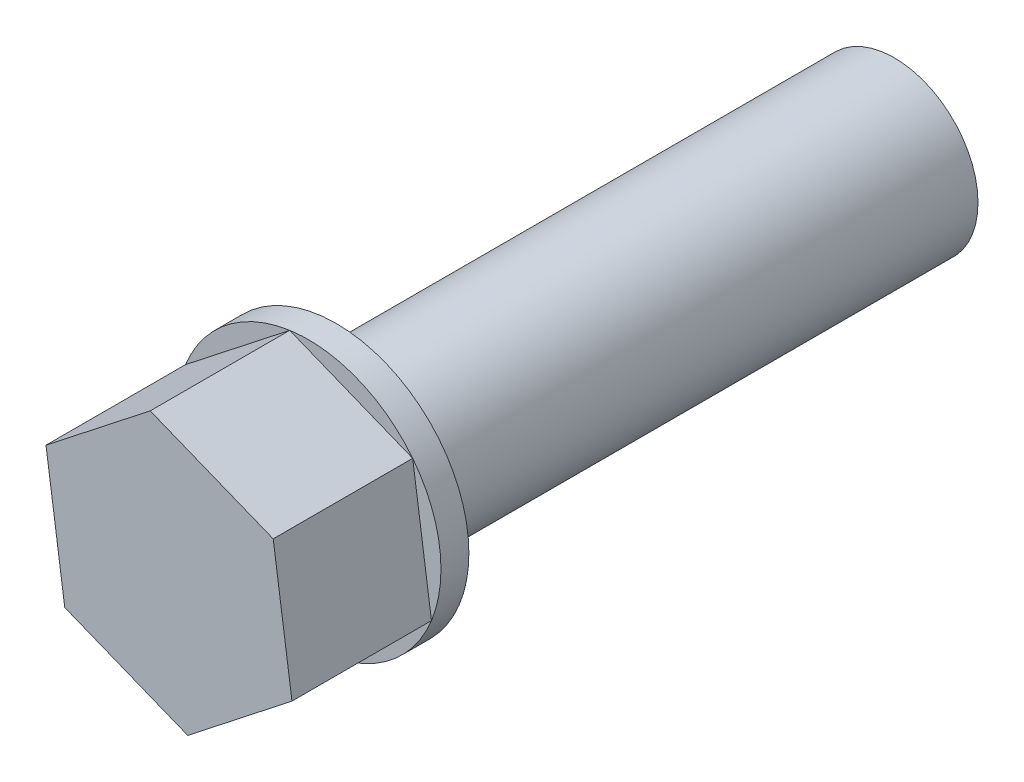
from build123d import *

# Parameters (mm, degrees)
CROQUIS1_R              = 6
SALIENTE_EXTRUIR1_DEPTH = 40
CROQUIS2_R              = 9.5
SALIENTE_EXTRUIR2_DEPTH = 2
SALIENTE_EXTRUIR3_DEPTH = 10


with BuildPart() as part:
    # Croquis1 → Saliente-Extruir1 (new body)
    with BuildSketch(Plane.XY):
        Circle(CROQUIS1_R)
    extrude(amount=SALIENTE_EXTRUIR1_DEPTH)

    # Croquis2 → Saliente-Extruir2 (add)
    with BuildSketch(Plane.XY.offset(40)):
        Circle(CROQUIS2_R)
    extrude(amount=SALIENTE_EXTRUIR2_DEPTH)

    # Croquis3 → Saliente-Extruir3 (add)
    with BuildSketch(Plane.XY.offset(42)):
        Polygon((-1.344767868, 9.404339391), (-8.816780752, 3.53756656), (-7.472012885, -5.866772831), (1.344767868, -9.404339391), (8.816780752, -3.53756656), (7.472012885, 5.866772831), align=None)
    extrude(amount=SALIENTE_EXTRUIR3_DEPTH)


solid = part.part
